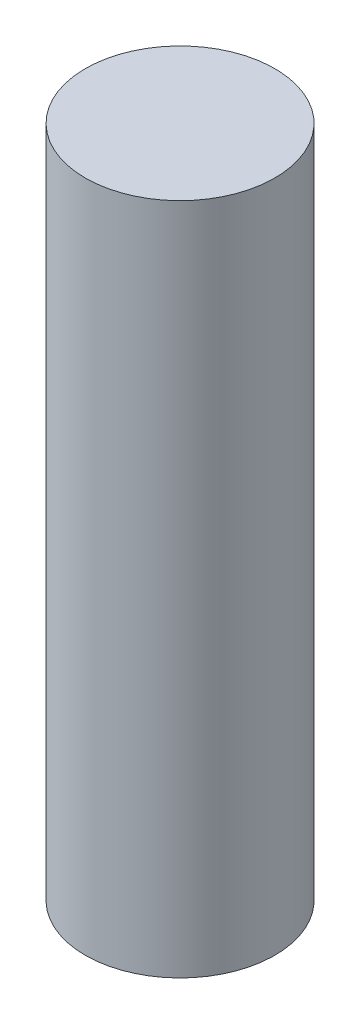
from build123d import *

# Parameters (mm, degrees)
SKETCH1_R           = 9.15
BOSS_EXTRUDE1_DEPTH = 32.5


with BuildPart() as part:
    # Sketch1 → Boss-Extrude1 (new, symmetric)
    with BuildSketch(Plane(origin=(0, 0, 0), x_dir=(1, 0, 0), z_dir=(0, 1, 0))):
        with Locations(Location((0, 0, 0), (0, 0, 270))):
            Circle(SKETCH1_R)
    extrude(amount=BOSS_EXTRUDE1_DEPTH, both=True)


solid = part.part
